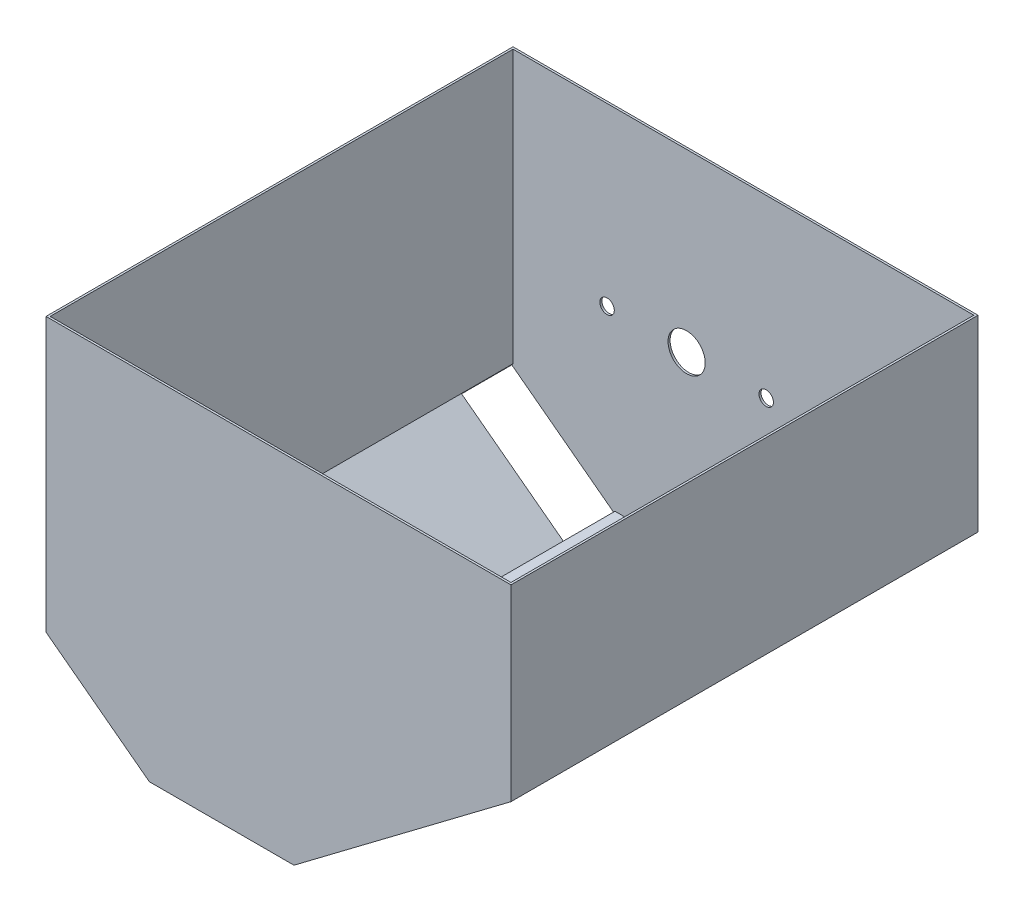
from build123d import *

# Parameters (mm, degrees)
SALIENTE_EXTRUIR1_DEPTH = 2
SALIENTE_EXTRUIR2_DEPTH = 450
SALIENTE_EXTRUIR3_DEPTH = 2
CROQUIS4_R              = 18
CORTAR_EXTRUIR1_DEPTH   = 2
CROQUIS5_W              = 123.547211961
CROQUIS5_H              = 50
CORTAR_EXTRUIR2_DEPTH   = 2
CROQUIS6_R              = 7
CORTAR_EXTRUIR3_DEPTH   = 2


with BuildPart() as part:
    # Croquis1 → Saliente-Extruir1 (new body)
    with BuildSketch(Plane.XY):
        Polygon((-70, -170), (70, -170), (280, -11.753649478), (280, 170), (-170, 170), (-170, -94.64459499), align=None)
    extrude(amount=SALIENTE_EXTRUIR1_DEPTH)

    # Croquis2 → Saliente-Extruir2 (add)
    with BuildSketch(Plane.XY.offset(2)):
        Polygon((-170, 170), (-168, 170), (-168, -93.647431774), (-69.330809361, -168), (69.330809361, -168), (278, -10.756486262), (278, 170), (280, 170), (280, -11.753649478), (70, -170), (-70, -170), (-170, -94.64459499), align=None)
    extrude(amount=SALIENTE_EXTRUIR2_DEPTH)

    # Croquis3 → Saliente-Extruir3 (add)
    with BuildSketch(Plane.XY.offset(452)):
        Polygon((-170, 170), (280, 170), (280, -11.753649478), (70, -170), (-70, -170), (-170, -94.64459499), align=None)
    extrude(amount=-SALIENTE_EXTRUIR3_DEPTH)

    # Croquis4 → Cortar-Extruir1 (cut)
    with BuildSketch(Plane.XY.offset(2)):
        Circle(CROQUIS4_R)
    extrude(amount=-CORTAR_EXTRUIR1_DEPTH, mode=Mode.SUBTRACT)

    # Croquis5 → Cortar-Extruir2 (cut)
    with BuildSketch(Plane(origin=(-105.856306655, -140.476063582, 0), x_dir=(0.7986355100472919, -0.6018150231520497, 0), z_dir=(0.6018150231520497, 0.7986355100472919, 0))):
        with Locations((-16.038728387, -27)):
            Rectangle(CROQUIS5_W, CROQUIS5_H)
    extrude(amount=-CORTAR_EXTRUIR2_DEPTH, mode=Mode.SUBTRACT)

    # Croquis6 → Cortar-Extruir3 (cut)
    with BuildSketch(Plane(origin=(0, 0, 0), x_dir=(-1, 0, 0), z_dir=(0, 0, -1))):
        with Locations((77, 0)):
            Circle(CROQUIS6_R)
        with Locations(Location((-77, 0, 0), (0, 0, 180))):
            Circle(CROQUIS6_R)
    extrude(amount=-CORTAR_EXTRUIR3_DEPTH, mode=Mode.SUBTRACT)


solid = part.part
